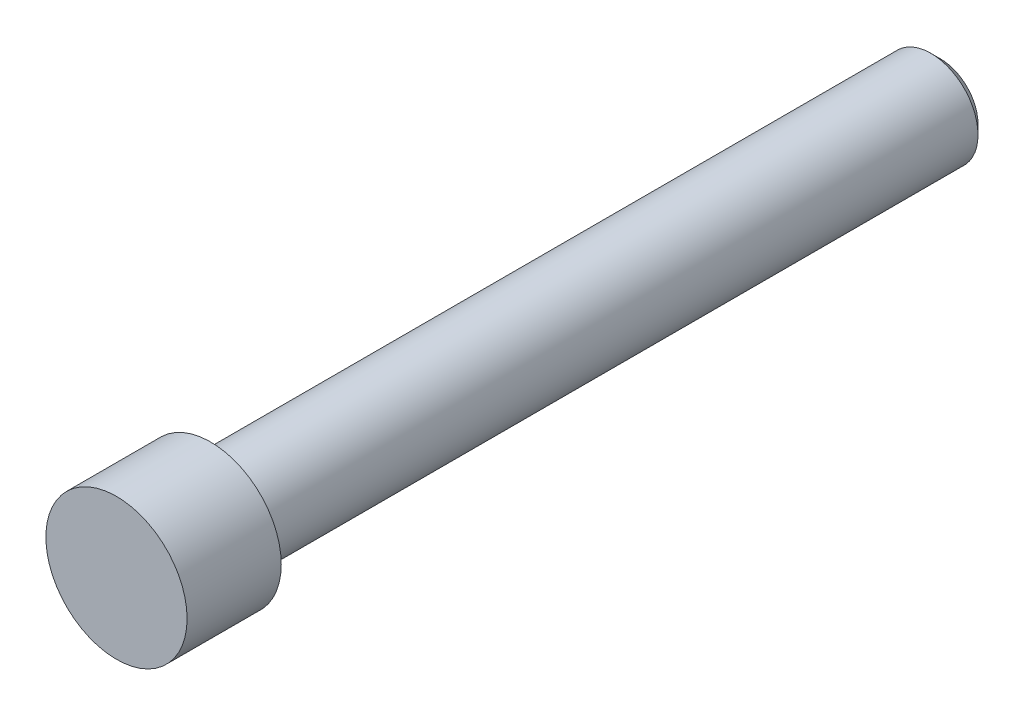
from build123d import *

# Parameters (mm, degrees)
CROQUIS1_R              = 1
SALIENTE_EXTRUIR1_DEPTH = 15.5
CROQUIS2_R              = 1.5
SALIENTE_EXTRUIR2_DEPTH = 2
CHAFL_N1_SIZE           = 0.2


with BuildPart() as part:
    # Croquis1 → Saliente-Extruir1 (new body)
    with BuildSketch(Plane.XY):
        Circle(CROQUIS1_R)
    extrude(amount=SALIENTE_EXTRUIR1_DEPTH)

    # Croquis2 → Saliente-Extruir2 (add)
    with BuildSketch(Plane.XY.offset(15.5)):
        Circle(CROQUIS2_R)
    extrude(amount=SALIENTE_EXTRUIR2_DEPTH)

    # Chaflán1
    chafl_n1_edges = [part.edges().sort_by_distance(p)[0] for p in [
        (-1, 0, 0),
    ]]
    chamfer(chafl_n1_edges, length=CHAFL_N1_SIZE)


solid = part.part
